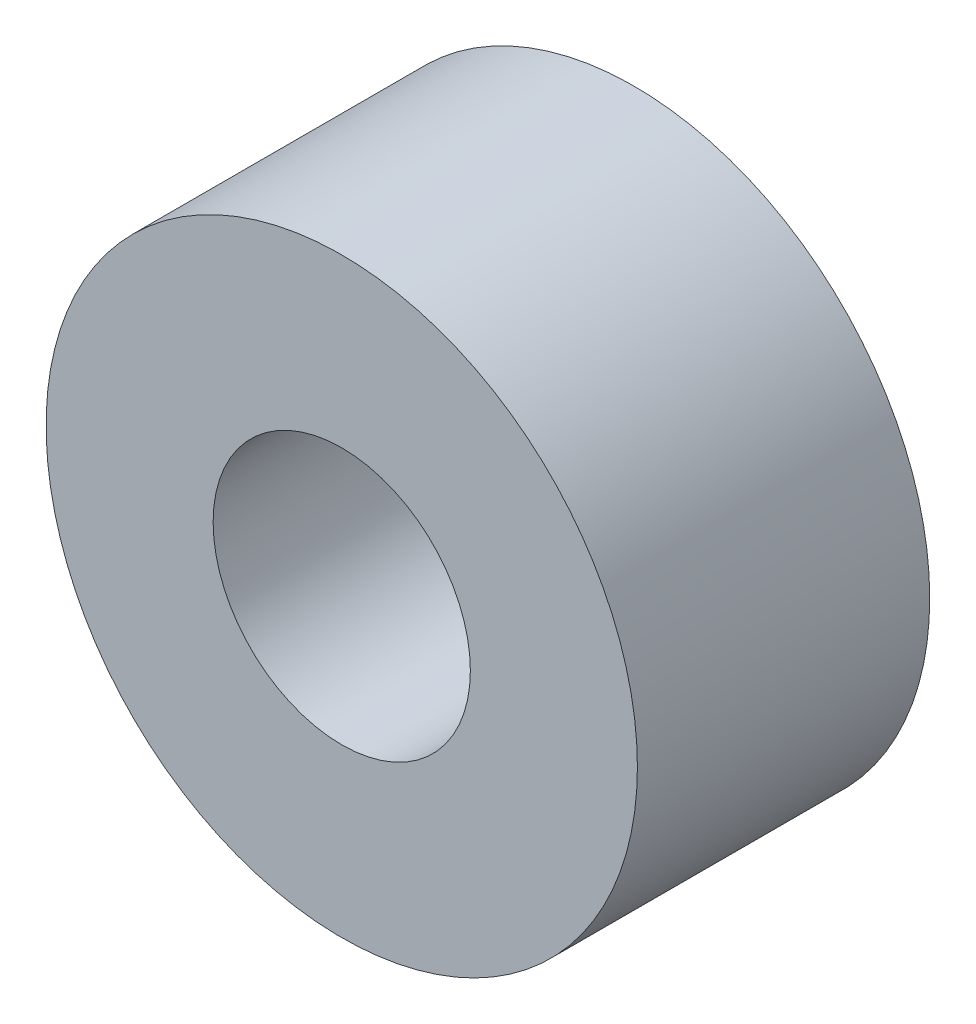
from build123d import *

# Parameters (mm, degrees)
SKETCH1_R           = 11.2395
SKETCH1_R_2         = 4.8895
BOSS_EXTRUDE1_DEPTH = 11.1125


with BuildPart() as part:
    # Sketch1 → Boss-Extrude1 (new body)
    with BuildSketch(Plane.XY):
        Circle(SKETCH1_R)
        Circle(SKETCH1_R_2, mode=Mode.SUBTRACT)
    extrude(amount=BOSS_EXTRUDE1_DEPTH)


solid = part.part
